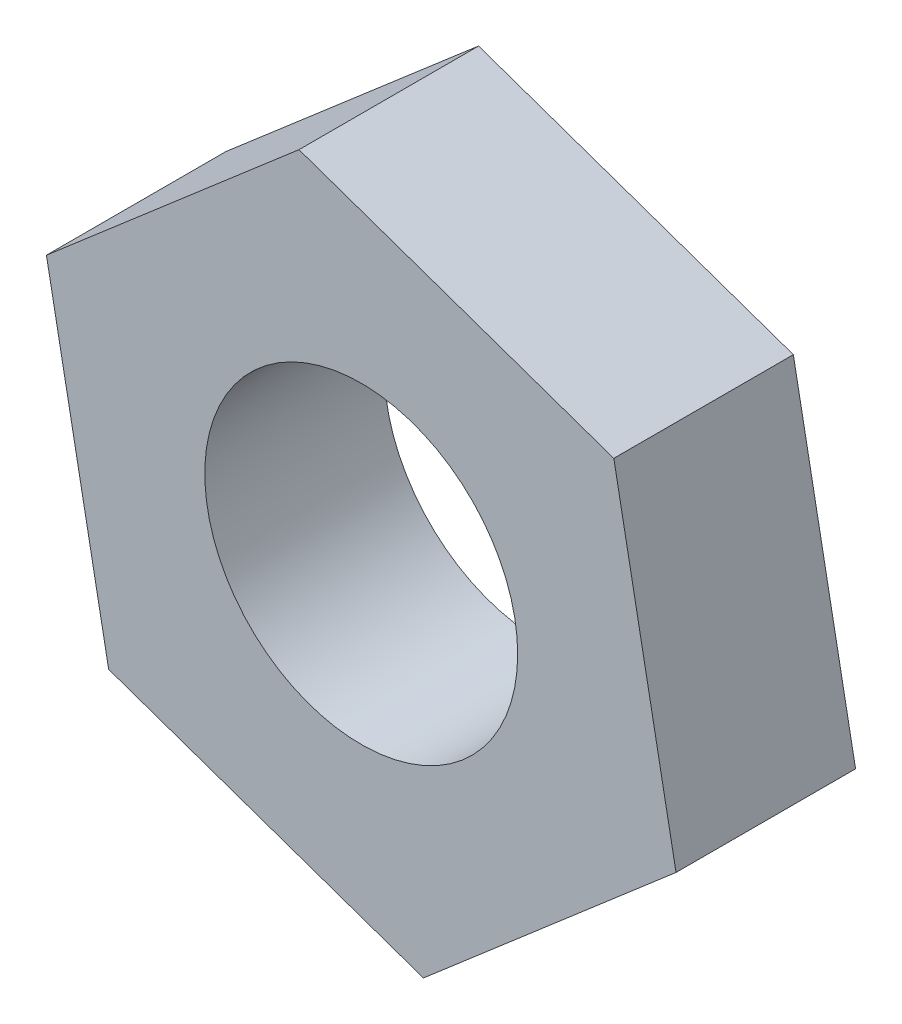
from build123d import *

# Parameters (mm, degrees)
SKETCH1_R           = 6.1
BOSS_EXTRUDE1_DEPTH = 7


with BuildPart() as part:
    # Sketch1 → Boss-Extrude1 (new body)
    with BuildSketch(Plane.XY):
        Polygon((2.42563283, -12.771699392), (12.273432539, -4.285190045), (9.847799708, 8.486509348), (-2.42563283, 12.771699392), (-12.273432539, 4.285190045), (-9.847799708, -8.486509348), align=None)
        Circle(SKETCH1_R, mode=Mode.SUBTRACT)
    extrude(amount=BOSS_EXTRUDE1_DEPTH)


solid = part.part
